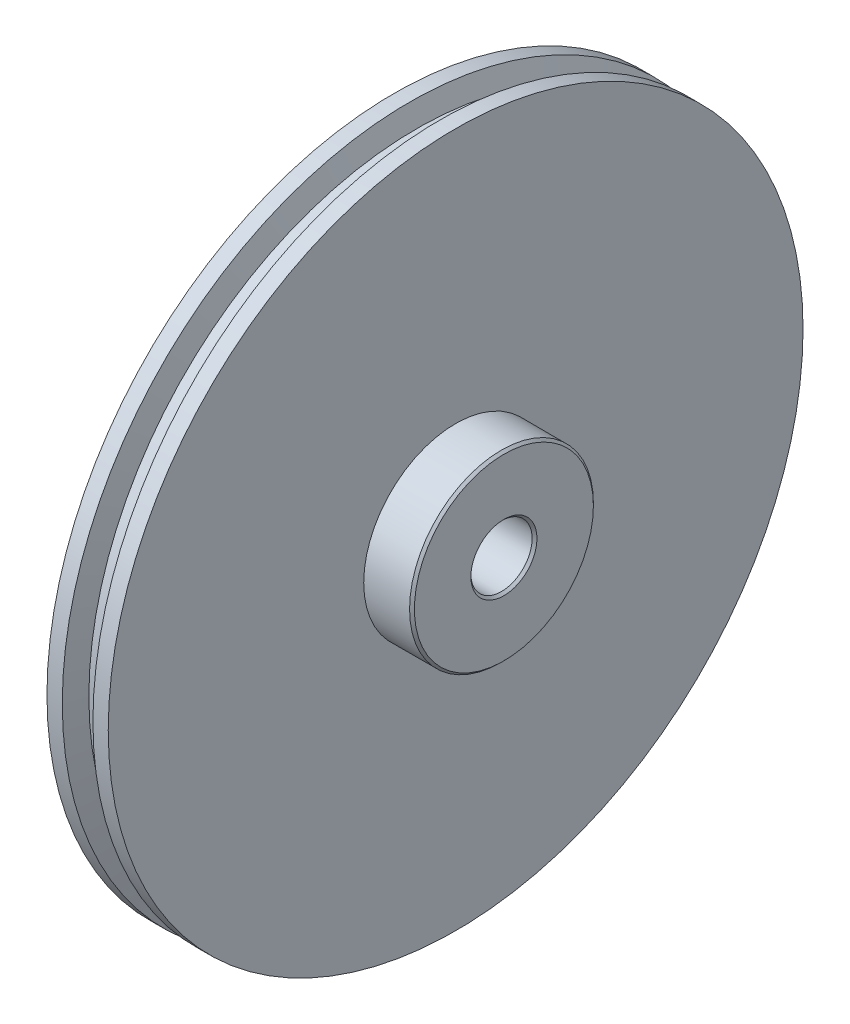
from build123d import *

# Parameters (mm, degrees)
SKETCH3_R           = 9.525
BOSS_EXTRUDE1_DEPTH = 5
SKETCH4_R           = 3.175
CUT_EXTRUDE1_DEPTH  = 53.161504004
CHAMFER1_SIZE       = 0.25


with BuildPart() as part:
    # Sketch2 → Revolve1 (revolve)
    with BuildSketch(Plane.XY, mode=Mode.PRIVATE) as revolve1_sk:
        Polygon((-3.175, 3.175), (3.175, 3.175), (3.175, 36), (1.5875, 36), (0.833641219, 34), (-0.833641219, 34), (-1.5875, 36), (-3.175, 36), align=None)
    revolve(revolve1_sk.sketch.rotate(Axis((0, 0, 0), (1, 0, 0)), 90), axis=Axis((0, 0, 0), (1, 0, 0)))

    # Sketch3 → Boss-Extrude1 (add)
    with BuildSketch(Plane(origin=(3.175, 0, 0), x_dir=(0, 0, -1), z_dir=(1, 0, 0))):
        with Locations(Location((0, 0, 0), (0, 0, 180))):
            Circle(SKETCH3_R)
    extrude(amount=BOSS_EXTRUDE1_DEPTH)

    # Sketch4 → Cut-Extrude1 (cut, through all)
    with BuildSketch(Plane(origin=(8.175, 0, 0), x_dir=(0, 0, -1), z_dir=(1, 0, 0))):
        with Locations(Location((0, 0, 0), (0, 0, 180))):
            Circle(SKETCH4_R)
    extrude(amount=-CUT_EXTRUDE1_DEPTH, mode=Mode.SUBTRACT)

    # Chamfer1
    chamfer1_edges = [part.edges().sort_by_distance(p)[0] for p in [
        (8.175, 0, -9.525),
        (8.175, 0, -3.175),
        (-3.175, 0, -3.175),
    ]]
    chamfer(chamfer1_edges, length=CHAMFER1_SIZE)


solid = part.part
